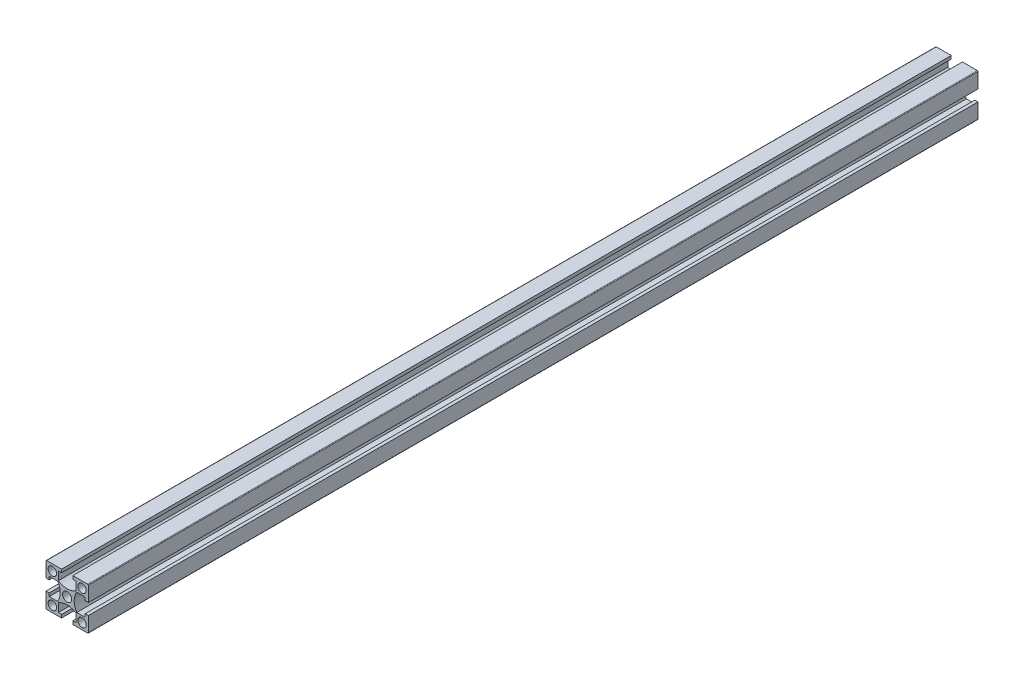
from build123d import *

# Parameters (mm, degrees)
SKETCH_1_W               = 20
SKETCH_1_H               = 20
SKETCH_1_R               = 2
SKETCH_1_R_2             = 2.15
EXTRUDE_1_DEPTH          = 420
CUT_EXTRUDE_1_REACH      = 422.238
PATTERN_CIRCULAR_1_COUNT = 4
FILLET_1_R               = 0.3
SKETCH_4_R               = 2.5
CUT_EXTRUDE_2_DEPTH      = 421.594816896
SKETCH_5_R               = 2.5
CUT_EXTRUDE_3_DEPTH      = 421.594816996
SKETCH_6_R               = 2.5
CUT_EXTRUDE_4_DEPTH      = 421.594816996


with BuildPart() as part:
    # 스케치1 → 보스-돌출1 (new body)
    with BuildSketch(Plane.XY):
        Rectangle(SKETCH_1_W, SKETCH_1_H)
        with Locations((-7, -7)):
            Circle(SKETCH_1_R, mode=Mode.SUBTRACT)
        with Locations((7, -7)):
            Circle(SKETCH_1_R, mode=Mode.SUBTRACT)
        with Locations((-7, 7)):
            Circle(SKETCH_1_R, mode=Mode.SUBTRACT)
        Circle(SKETCH_1_R_2, mode=Mode.SUBTRACT)
        with Locations((7, 7)):
            Circle(SKETCH_1_R, mode=Mode.SUBTRACT)
    extrude(amount=EXTRUDE_1_DEPTH)

    # 스케치1<3> → 컷-돌출1 (cut, up to next)
    with BuildSketch(Plane.XY, mode=Mode.PRIVATE) as cut_extrude_1_sk1:
        with BuildLine():
            Line((-8.5, 2.65), (-10, 2.65))
            Line((-10, 2.65), (-10, -2.65))
            Line((-10, -2.65), (-8.5, -2.65))
            Line((-8.5, -2.65), (-8.5, -4.15))
            Line((-8.5, -4.15), (-4.503166667, -4.15))
            ThreePointArc((-4.503166667, -4.15), (-3.3, 0), (-4.503166667, 4.15))
            Line((-4.503166667, 4.15), (-8.5, 4.15))
            Line((-8.5, 4.15), (-8.5, 2.65))
        make_face()
    cut_extrude_1_tool1 = extrude(cut_extrude_1_sk1.sketch, amount=CUT_EXTRUDE_1_REACH, mode=Mode.PRIVATE) & part.part
    cut_extrude_1 = cut_extrude_1_tool1.solids().sort_by_distance((-6.606913, 0, 0))[0]
    add(cut_extrude_1, mode=Mode.SUBTRACT)

    # 원형 패턴1: 컷-돌출1 ×4 about axis
    pattern_circular_1_axis = Axis((0, 0, 420), (0, 0, -1))
    for i in range(1, PATTERN_CIRCULAR_1_COUNT):
        add(cut_extrude_1.rotate(pattern_circular_1_axis, i * 360 / PATTERN_CIRCULAR_1_COUNT), mode=Mode.SUBTRACT)

    # 필렛1
    fillet_1_edges = [part.edges().sort_by_distance(p)[0] for p in [
        (10, -10, 210),
        (-10, -10, 210),
        (-10, 10, 210),
        (10, 10, 210),
    ]]
    fillet(fillet_1_edges, radius=FILLET_1_R)

    # 스케치4 → 컷-돌출2 (cut, through all)
    with BuildSketch(Plane(origin=(0, 10, 0), x_dir=(1, 0, 0), z_dir=(0, 1, 0))):
        with Locations((0, -11)):
            Circle(SKETCH_4_R)
        with Locations((0, -409)):
            Circle(SKETCH_4_R)
    extrude(amount=-CUT_EXTRUDE_2_DEPTH, mode=Mode.SUBTRACT)

    # 스케치5 → 컷-돌출3 (cut, through all)
    with BuildSketch(Plane.ZY.offset(10)):
        with Locations((131, 0)):
            Circle(SKETCH_5_R)
        with Locations((289, 0)):
            Circle(SKETCH_5_R)
    extrude(amount=-CUT_EXTRUDE_3_DEPTH, mode=Mode.SUBTRACT)

    # 스케치6 → 컷-돌출4 (cut, through all)
    with BuildSketch(Plane(origin=(0, 10, 0), x_dir=(1, 0, 0), z_dir=(0, 1, 0))):
        with Locations((0, -110)):
            Circle(SKETCH_6_R)
        with Locations((0, -310)):
            Circle(SKETCH_6_R)
    extrude(amount=-CUT_EXTRUDE_4_DEPTH, mode=Mode.SUBTRACT)


solid = part.part
